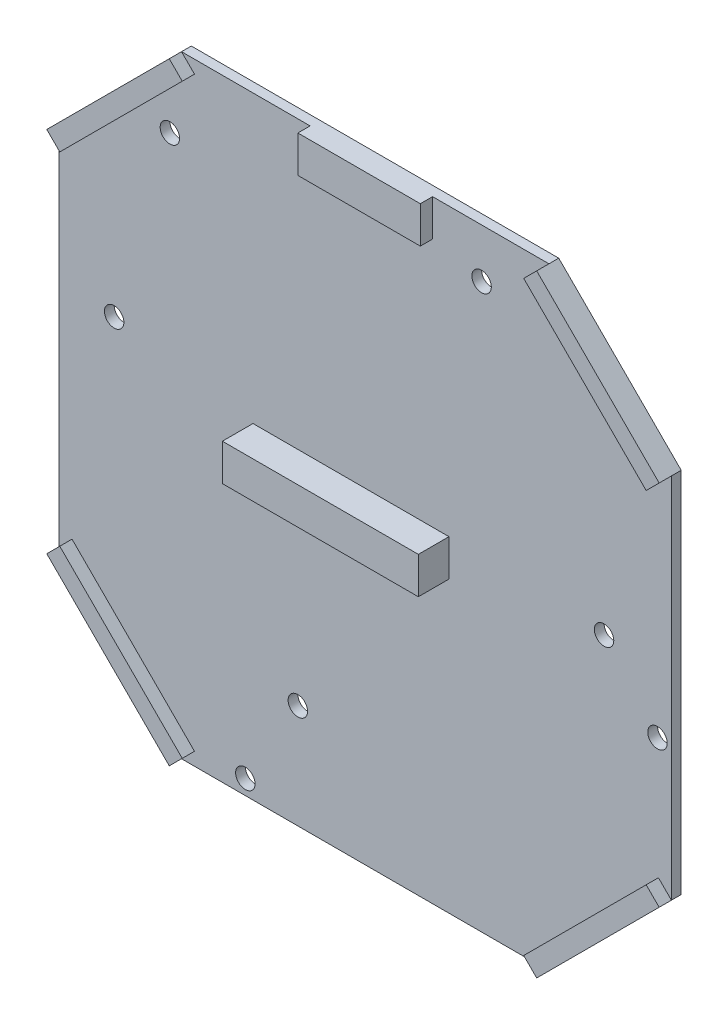
from build123d import *

# Parameters (mm, degrees)
SKETCH1_W           = 100
SKETCH1_H           = 100
BOSS_EXTRUDE1_DEPTH = 1.6
CUT_EXTRUDE1_DEPTH  = 1.6
SKETCH7_R           = 1.5875
CUT_EXTRUDE2_DEPTH  = 1.6
SKETCH8_W           = 32
SKETCH8_H           = 6
BOSS_EXTRUDE2_DEPTH = 5
BOSS_EXTRUDE3_DEPTH = 2
SKETCH12_W          = 20
SKETCH12_H          = 6
BOSS_EXTRUDE5_DEPTH = 2


with BuildPart() as part:
    # Sketch1 → Boss-Extrude1 (new body)
    with BuildSketch(Plane.XY):
        with Locations((15.275668243, 27.330907947)):
            Rectangle(SKETCH1_W, SKETCH1_H)
    extrude(amount=BOSS_EXTRUDE1_DEPTH)

    # Sketch2 → Cut-Extrude1 (cut)
    with BuildSketch(Plane.XY.offset(1.6)):
        Polygon((-34.724331757, 57.330907947), (-14.724331757, 77.330907947), (-34.724331757, 77.330907947), align=None)
        Polygon((-34.724331757, -2.669092053), (-14.724331757, -22.669092053), (-34.724331757, -22.669092053), align=None)
        Polygon((45.275668243, 77.330907947), (65.275668243, 57.330907947), (65.275668243, 77.330907947), align=None)
        Polygon((65.275668243, -2.669092053), (45.275668243, -22.669092053), (65.275668243, -22.669092053), align=None)
    extrude(amount=-CUT_EXTRUDE1_DEPTH, mode=Mode.SUBTRACT)

    # Sketch7 → Cut-Extrude2 (cut)
    with BuildSketch(Plane.XY.offset(1.6)):
        with Locations((-25.724331757, 34.330907947)):
            Circle(SKETCH7_R)
        with Locations((-16.624331757, 64.904907947)):
            Circle(SKETCH7_R)
        with Locations((34.275668243, 69.330907947)):
            Circle(SKETCH7_R)
        with Locations((54.275668243, 29.330907947)):
            Circle(SKETCH7_R)
        with Locations((62.999668243, 19.180907947)):
            Circle(SKETCH7_R)
        with Locations((-4.300331757, -20.219092053)):
            Circle(SKETCH7_R)
        with Locations((4.275668243, -5.669092053)):
            Circle(SKETCH7_R)
    extrude(amount=-CUT_EXTRUDE2_DEPTH, mode=Mode.SUBTRACT)

    # Sketch8 → Boss-Extrude2 (add)
    with BuildSketch(Plane.XY.offset(1.6)):
        with Locations((12.949668243, 27.580907947)):
            Rectangle(SKETCH8_W, SKETCH8_H)
    extrude(amount=BOSS_EXTRUDE2_DEPTH)

    # Sketch10 → Boss-Extrude3 (add)
    with BuildSketch(Plane.XY.offset(1.6)):
        Polygon((-34.724331757, 57.330907947), (-14.724331757, 77.330907947), (-12.603011413, 75.209587604), (-32.603011413, 55.209587604), align=None)
        Polygon((45.275668243, 77.330907947), (65.275668243, 57.330907947), (63.154347899, 55.209587604), (43.154347899, 75.209587604), align=None)
        Polygon((65.275668243, -2.669092053), (45.275668243, -22.669092053), (43.154347899, -20.547771709), (63.154347899, -0.547771709), align=None)
        Polygon((-14.724331757, -22.669092053), (-34.724331757, -2.669092053), (-32.603011413, -0.547771709), (-12.603011413, -20.547771709), align=None)
    extrude(amount=BOSS_EXTRUDE3_DEPTH)

    # Sketch12 → Boss-Extrude5 (add)
    with BuildSketch(Plane.XY.offset(1.6)):
        with Locations((16.275668243, 74.330907947)):
            Rectangle(SKETCH12_W, SKETCH12_H)
    extrude(amount=BOSS_EXTRUDE5_DEPTH)


solid = part.part
